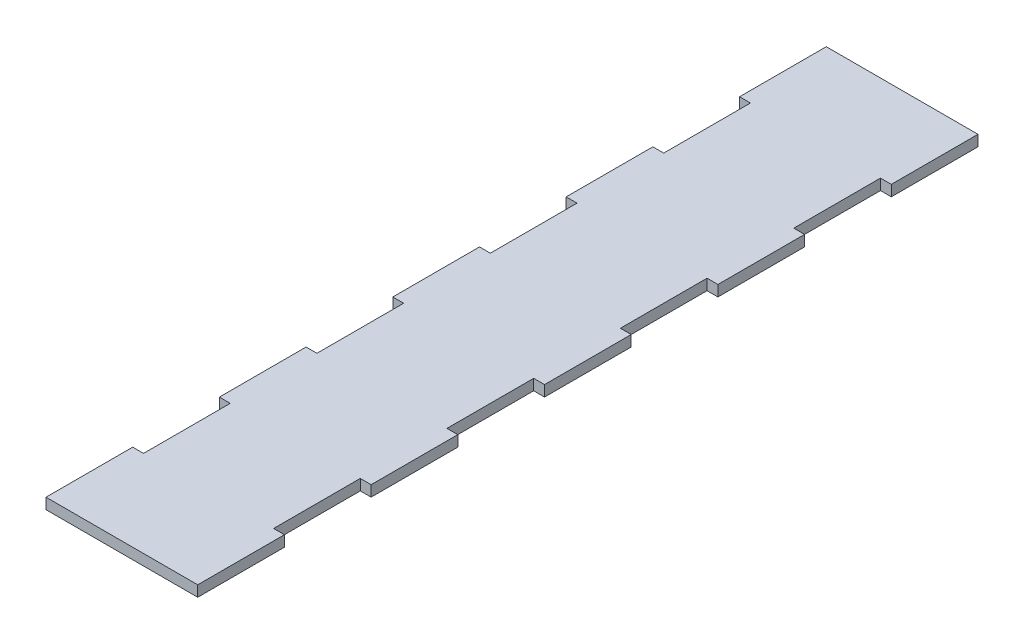
from build123d import *

# Parameters (mm, degrees)
SKETCH1_W               = 76.2
SKETCH1_H               = 6.35
BASE_EXTRUSION_DEPTH    = 457.2
SKETCH2_W               = 6.35
SKETCH2_H               = 50.8
TAB_DEPTH               = 6.35
LPATTERN1_COUNT         = 5
LPATTERN1_PITCH         = 101.6
MIRROR2_COPY_1_SKETCH_W = 6.35
MIRROR2_COPY_1_SKETCH_H = 50.8
MIRROR2_COPY_1_DEPTH    = 6.35
MIRROR2_COPY_2_SKETCH_W = 6.35
MIRROR2_COPY_2_SKETCH_H = 50.8
MIRROR2_COPY_2_DEPTH    = 6.35
MIRROR2_COPY_3_SKETCH_W = 6.35
MIRROR2_COPY_3_SKETCH_H = 50.8
MIRROR2_COPY_3_DEPTH    = 6.35
MIRROR2_COPY_4_SKETCH_W = 6.35
MIRROR2_COPY_4_SKETCH_H = 50.8
MIRROR2_COPY_4_DEPTH    = 6.35


with BuildPart() as part:
    # Sketch1 → Base Extrusion (new body)
    with BuildSketch(Plane.XY):
        with Locations((0, 41.275)):
            Rectangle(SKETCH1_W, SKETCH1_H)
    extrude(amount=BASE_EXTRUSION_DEPTH)

    # Sketch2 → Tab (add)
    with BuildSketch(Plane(origin=(0, 44.45, 0), x_dir=(1, 0, 0), z_dir=(0, 1, 0))):
        with Locations((-41.275, -431.8)):
            Rectangle(SKETCH2_W, SKETCH2_H)
    tab = extrude(amount=-TAB_DEPTH)

    # LPattern1: Tab ×5
    with Locations(*[(0, 0, -i * LPATTERN1_PITCH) for i in range(1, LPATTERN1_COUNT)]):
        add(tab)

    # Mirror2: Tab across plane
    add(tab.mirror(Plane(origin=(0, 0, 0), x_dir=(0, 0, 1), z_dir=(1, 0, 0))))

    # Mirror2 copy 1 sketch → Mirror2 copy 1 (add)
    with BuildSketch(Plane(origin=(0, 44.45, -101.6), x_dir=(-1, 0, 0), z_dir=(0, 1, 0))):
        with Locations((-41.275, 431.8)):
            Rectangle(MIRROR2_COPY_1_SKETCH_W, MIRROR2_COPY_1_SKETCH_H)
    extrude(amount=-MIRROR2_COPY_1_DEPTH)

    # Mirror2 copy 2 sketch → Mirror2 copy 2 (add)
    with BuildSketch(Plane(origin=(0, 44.45, -203.2), x_dir=(-1, 0, 0), z_dir=(0, 1, 0))):
        with Locations((-41.275, 431.8)):
            Rectangle(MIRROR2_COPY_2_SKETCH_W, MIRROR2_COPY_2_SKETCH_H)
    extrude(amount=-MIRROR2_COPY_2_DEPTH)

    # Mirror2 copy 3 sketch → Mirror2 copy 3 (add)
    with BuildSketch(Plane(origin=(0, 44.45, -304.8), x_dir=(-1, 0, 0), z_dir=(0, 1, 0))):
        with Locations((-41.275, 431.8)):
            Rectangle(MIRROR2_COPY_3_SKETCH_W, MIRROR2_COPY_3_SKETCH_H)
    extrude(amount=-MIRROR2_COPY_3_DEPTH)

    # Mirror2 copy 4 sketch → Mirror2 copy 4 (add)
    with BuildSketch(Plane(origin=(0, 44.45, -406.4), x_dir=(-1, 0, 0), z_dir=(0, 1, 0))):
        with Locations((-41.275, 431.8)):
            Rectangle(MIRROR2_COPY_4_SKETCH_W, MIRROR2_COPY_4_SKETCH_H)
    extrude(amount=-MIRROR2_COPY_4_DEPTH)


solid = part.part
